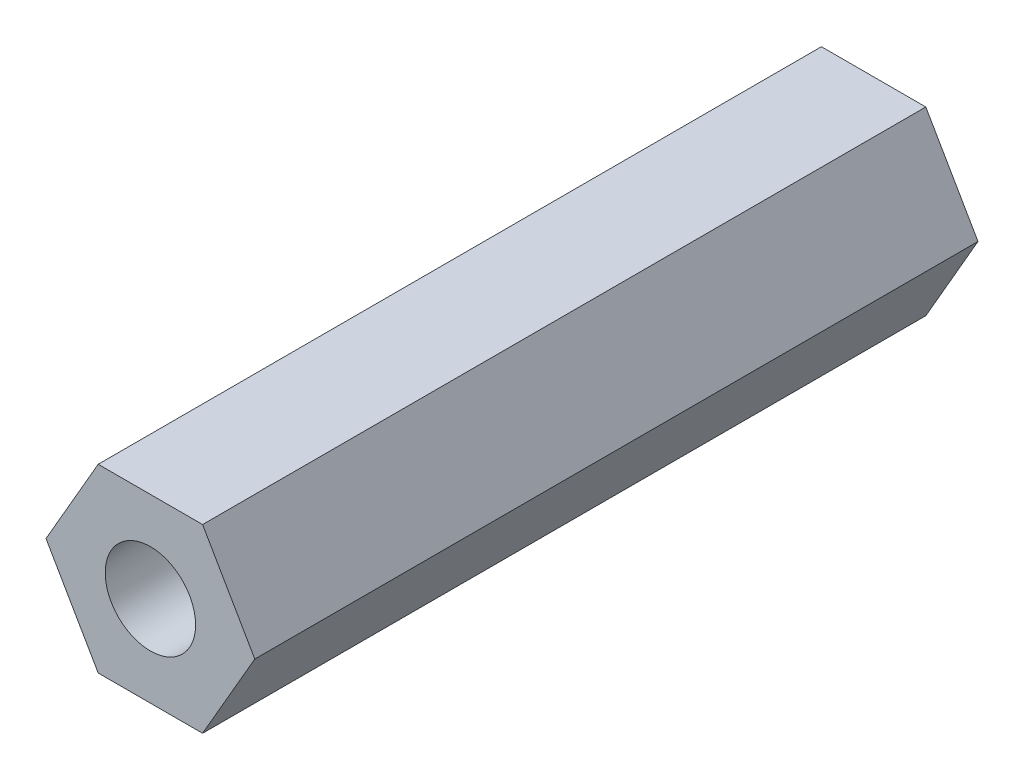
from build123d import *

# Parameters (mm, degrees)
SKETCH1_R           = 3.175
BOSS_EXTRUDE1_DEPTH = 50.8


with BuildPart() as part:
    # Sketch1 → Boss-Extrude1 (new body)
    with BuildSketch(Plane.XY):
        Polygon((3.666174209, 6.35), (-3.666174209, 6.35), (-7.332348419, 0), (-3.666174209, -6.35), (3.666174209, -6.35), (7.332348419, 0), align=None)
        Circle(SKETCH1_R, mode=Mode.SUBTRACT)
    extrude(amount=BOSS_EXTRUDE1_DEPTH)


solid = part.part
